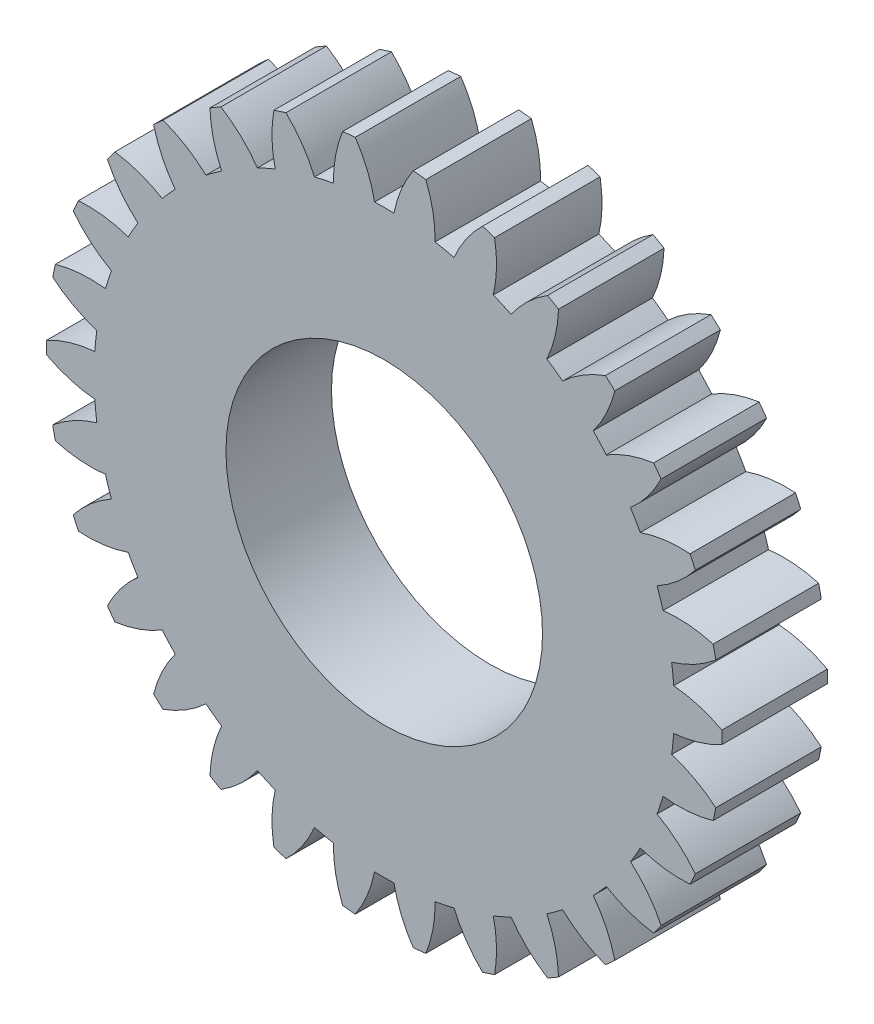
from build123d import *

# Parameters (mm, degrees)
SKETCH_1_R      = 15
EXTRUDE_1_DEPTH = 10


with BuildPart() as part:
    # 草圖1 → 填料-伸長1 (new body)
    with BuildSketch(Plane.XY):
        with BuildLine():
            ThreePointArc((-31.994334603, -0.602124009), (-29.77973059, -1.509475958), (-27.429110937, -1.959304527))
            ThreePointArc((-27.429110937, -1.959304527), (-27.348357601, -2.874428211), (-27.23708137, -3.786343811))
            ThreePointArc((-27.23708137, -3.786343811), (-29.442809726, -4.715063852), (-31.42037025, -6.063030049))
            ThreePointArc((-31.42037025, -6.063030049), (-31.300723223, -6.653174106), (-31.169993008, -7.240962359))
            ThreePointArc((-31.169993008, -7.240962359), (-28.815134328, -7.668044426), (-26.422356736, -7.619321854))
            ThreePointArc((-26.422356736, -7.619321854), (-26.153103142, -8.497658328), (-25.854660649, -9.366510754))
            ThreePointArc((-25.854660649, -9.366510754), (-27.819096794, -10.733532747), (-29.473184945, -12.4632006))
            ThreePointArc((-29.473184945, -12.4632006), (-29.233454645, -13.015572578), (-28.983373149, -13.563335907))
            ThreePointArc((-28.983373149, -13.563335907), (-26.591178426, -13.491482557), (-24.260818757, -12.946338255))
            ThreePointArc((-24.260818757, -12.946338255), (-23.814832579, -13.7495), (-23.342267194, -14.537316233))
            ThreePointArc((-23.342267194, -14.537316233), (-24.979555842, -16.282894755), (-26.23788003, -18.31866948))
            ThreePointArc((-26.23788003, -18.31866948), (-25.88854382, -18.809128073), (-25.530040805, -19.292926592))
            ThreePointArc((-25.530040805, -19.292926592), (-23.205060428, -18.725278161), (-21.038966583, -17.707537551))
            ThreePointArc((-21.038966583, -17.707537551), (-20.435739556, -18.400422544), (-19.809704653, -19.072771234))
            ThreePointArc((-19.809704653, -19.072771234), (-21.048288434, -21.120616129), (-21.855853854, -23.373524601))
            ThreePointArc((-21.855853854, -23.373524601), (-21.412179403, -23.780634415), (-20.960923171, -24.179323808))
            ThreePointArc((-20.960923171, -24.179323808), (-18.804769939, -23.140689255), (-16.897610612, -21.694832486))
            ThreePointArc((-16.897610612, -21.694832486), (-16.163506653, -22.247158328), (-15.411362962, -22.774654611))
            ThreePointArc((-15.411362962, -22.774654611), (-16.197109821, -25.035265229), (-16.518621989, -27.406844539))
            ThreePointArc((-16.518621989, -27.406844539), (-16, -27.712812921), (-15.475712613, -28.008968548))
            ThreePointArc((-15.475712613, -28.008968548), (-13.582620769, -26.544741188), (-12.017747974, -24.733959138))
            ThreePointArc((-12.017747974, -24.733959138), (-11.184850948, -25.12158654), (-10.339470758, -25.481176297))
            ThreePointArc((-10.339470758, -25.481176297), (-10.638039786, -27.855753107), (-10.459447078, -30.242353857))
            ThreePointArc((-10.459447078, -30.242353857), (-9.88854382, -30.433808521), (-9.314139154, -30.61448696))
            ThreePointArc((-9.314139154, -30.61448696), (-7.766845894, -28.788660555), (-6.612652082, -26.692093088))
            ThreePointArc((-6.612652082, -26.692093088), (-5.717363586, -26.898080873), (-4.815694067, -27.074048306))
            ThreePointArc((-4.815694067, -27.074048306), (-4.614036366, -29.458810907), (-3.94314414, -31.756127193))
            ThreePointArc((-3.94314414, -31.756127193), (-3.344910825, -31.824700652), (-2.745493119, -31.882005388))
            ThreePointArc((-2.745493119, -31.882005388), (-1.611622584, -29.774377312), (-0.918551563, -27.483654488))
            ThreePointArc((-0.918551563, -27.483654488), (0, -27.499), (0.918551563, -27.483654488))
            ThreePointArc((0.918551563, -27.483654488), (1.611622584, -29.774377312), (2.745493119, -31.882005388))
            ThreePointArc((2.745493119, -31.882005388), (3.344910825, -31.824700652), (3.94314414, -31.756127193))
            ThreePointArc((3.94314414, -31.756127193), (4.614036366, -29.458810907), (4.815694067, -27.074048306))
            ThreePointArc((4.815694067, -27.074048306), (5.717363586, -26.898080873), (6.612652082, -26.692093088))
            ThreePointArc((6.612652082, -26.692093088), (7.766845894, -28.788660555), (9.314139154, -30.61448696))
            ThreePointArc((9.314139154, -30.61448696), (9.88854382, -30.433808521), (10.459447078, -30.242353857))
            ThreePointArc((10.459447078, -30.242353857), (10.638039786, -27.855753107), (10.339470758, -25.481176297))
            ThreePointArc((10.339470758, -25.481176297), (11.184850948, -25.12158654), (12.017747974, -24.733959138))
            ThreePointArc((12.017747974, -24.733959138), (13.582620769, -26.544741188), (15.475712613, -28.008968548))
            ThreePointArc((15.475712613, -28.008968548), (16, -27.712812921), (16.518621989, -27.406844539))
            ThreePointArc((16.518621989, -27.406844539), (16.197109821, -25.035265229), (15.411362962, -22.774654611))
            ThreePointArc((15.411362962, -22.774654611), (16.163506653, -22.247158328), (16.897610612, -21.694832486))
            ThreePointArc((16.897610612, -21.694832486), (18.804769939, -23.140689255), (20.960923171, -24.179323808))
            ThreePointArc((20.960923171, -24.179323808), (21.412179403, -23.780634415), (21.855853854, -23.373524601))
            ThreePointArc((21.855853854, -23.373524601), (21.048288434, -21.120616129), (19.809704653, -19.072771234))
            ThreePointArc((19.809704653, -19.072771234), (20.435739556, -18.400422544), (21.038966583, -17.707537551))
            ThreePointArc((21.038966583, -17.707537551), (23.205060428, -18.725278161), (25.530040805, -19.292926592))
            ThreePointArc((25.530040805, -19.292926592), (25.88854382, -18.809128073), (26.23788003, -18.31866948))
            ThreePointArc((26.23788003, -18.31866948), (24.979555842, -16.282894755), (23.342267194, -14.537316233))
            ThreePointArc((23.342267194, -14.537316233), (23.814832579, -13.7495), (24.260818757, -12.946338255))
            ThreePointArc((24.260818757, -12.946338255), (26.591178426, -13.491482557), (28.983373149, -13.563335907))
            ThreePointArc((28.983373149, -13.563335907), (29.233454645, -13.015572578), (29.473184945, -12.4632006))
            ThreePointArc((29.473184945, -12.4632006), (27.819096794, -10.733532747), (25.854660649, -9.366510754))
            ThreePointArc((25.854660649, -9.366510754), (26.153103142, -8.497658328), (26.422356736, -7.619321854))
            ThreePointArc((26.422356736, -7.619321854), (28.815134328, -7.668044426), (31.169993008, -7.240962359))
            ThreePointArc((31.169993008, -7.240962359), (31.300723223, -6.653174106), (31.42037025, -6.063030049))
            ThreePointArc((31.42037025, -6.063030049), (29.442809726, -4.715063852), (27.23708137, -3.786343811))
            ThreePointArc((27.23708137, -3.786343811), (27.348357601, -2.874428211), (27.429110937, -1.959304527))
            ThreePointArc((27.429110937, -1.959304527), (29.77973059, -1.509475958), (31.994334603, -0.602124009))
            ThreePointArc((31.994334603, -0.602124009), (32, 0), (31.994334603, 0.602124009))
            ThreePointArc((31.994334603, 0.602124009), (29.77973059, 1.509475958), (27.429110937, 1.959304527))
            ThreePointArc((27.429110937, 1.959304527), (27.348357601, 2.874428211), (27.23708137, 3.786343811))
            ThreePointArc((27.23708137, 3.786343811), (29.442809726, 4.715063852), (31.42037025, 6.063030049))
            ThreePointArc((31.42037025, 6.063030049), (31.300723223, 6.653174106), (31.169993008, 7.240962359))
            ThreePointArc((31.169993008, 7.240962359), (28.815134328, 7.668044426), (26.422356736, 7.619321854))
            ThreePointArc((26.422356736, 7.619321854), (26.153103142, 8.497658328), (25.854660649, 9.366510754))
            ThreePointArc((25.854660649, 9.366510754), (27.819096794, 10.733532747), (29.473184945, 12.4632006))
            ThreePointArc((29.473184945, 12.4632006), (29.233454645, 13.015572578), (28.983373149, 13.563335907))
            ThreePointArc((28.983373149, 13.563335907), (26.591178426, 13.491482557), (24.260818757, 12.946338255))
            ThreePointArc((24.260818757, 12.946338255), (23.814832579, 13.7495), (23.342267194, 14.537316233))
            ThreePointArc((23.342267194, 14.537316233), (24.979555842, 16.282894755), (26.23788003, 18.31866948))
            ThreePointArc((26.23788003, 18.31866948), (25.88854382, 18.809128073), (25.530040805, 19.292926592))
            ThreePointArc((25.530040805, 19.292926592), (23.205060428, 18.725278161), (21.038966583, 17.707537551))
            ThreePointArc((21.038966583, 17.707537551), (20.435739556, 18.400422544), (19.809704653, 19.072771234))
            ThreePointArc((19.809704653, 19.072771234), (21.048288434, 21.120616129), (21.855853854, 23.373524601))
            ThreePointArc((21.855853854, 23.373524601), (21.412179403, 23.780634415), (20.960923171, 24.179323808))
            ThreePointArc((20.960923171, 24.179323808), (18.804769939, 23.140689255), (16.897610612, 21.694832486))
            ThreePointArc((16.897610612, 21.694832486), (16.163506653, 22.247158328), (15.411362962, 22.774654611))
            ThreePointArc((15.411362962, 22.774654611), (16.197109821, 25.035265229), (16.518621989, 27.406844539))
            ThreePointArc((16.518621989, 27.406844539), (16, 27.712812921), (15.475712613, 28.008968548))
            ThreePointArc((15.475712613, 28.008968548), (13.582620769, 26.544741188), (12.017747974, 24.733959138))
            ThreePointArc((12.017747974, 24.733959138), (11.184850948, 25.12158654), (10.339470758, 25.481176297))
            ThreePointArc((10.339470758, 25.481176297), (10.638039786, 27.855753107), (10.459447078, 30.242353857))
            ThreePointArc((10.459447078, 30.242353857), (9.88854382, 30.433808521), (9.314139154, 30.61448696))
            ThreePointArc((9.314139154, 30.61448696), (7.766845894, 28.788660555), (6.612652082, 26.692093088))
            ThreePointArc((6.612652082, 26.692093088), (5.717363586, 26.898080873), (4.815694067, 27.074048306))
            ThreePointArc((4.815694067, 27.074048306), (4.614036366, 29.458810907), (3.94314414, 31.756127193))
            ThreePointArc((3.94314414, 31.756127193), (3.344910825, 31.824700652), (2.745493119, 31.882005388))
            ThreePointArc((2.745493119, 31.882005388), (1.611622584, 29.774377312), (0.918551563, 27.483654488))
            ThreePointArc((0.918551563, 27.483654488), (0, 27.499), (-0.918551563, 27.483654488))
            ThreePointArc((-0.918551563, 27.483654488), (-1.611622584, 29.774377312), (-2.745493119, 31.882005388))
            ThreePointArc((-2.745493119, 31.882005388), (-3.344910825, 31.824700652), (-3.94314414, 31.756127193))
            ThreePointArc((-3.94314414, 31.756127193), (-4.614036366, 29.458810907), (-4.815694067, 27.074048306))
            ThreePointArc((-4.815694067, 27.074048306), (-5.717363586, 26.898080873), (-6.612652082, 26.692093088))
            ThreePointArc((-6.612652082, 26.692093088), (-7.766845894, 28.788660555), (-9.314139154, 30.61448696))
            ThreePointArc((-9.314139154, 30.61448696), (-9.88854382, 30.433808521), (-10.459447078, 30.242353857))
            ThreePointArc((-10.459447078, 30.242353857), (-10.638039786, 27.855753107), (-10.339470758, 25.481176297))
            ThreePointArc((-10.339470758, 25.481176297), (-11.184850948, 25.12158654), (-12.017747974, 24.733959138))
            ThreePointArc((-12.017747974, 24.733959138), (-13.582620769, 26.544741188), (-15.475712613, 28.008968548))
            ThreePointArc((-15.475712613, 28.008968548), (-16, 27.712812921), (-16.518621989, 27.406844539))
            ThreePointArc((-16.518621989, 27.406844539), (-16.197109821, 25.035265229), (-15.411362962, 22.774654611))
            ThreePointArc((-15.411362962, 22.774654611), (-16.163506653, 22.247158328), (-16.897610612, 21.694832486))
            ThreePointArc((-16.897610612, 21.694832486), (-18.804769939, 23.140689255), (-20.960923171, 24.179323808))
            ThreePointArc((-20.960923171, 24.179323808), (-21.412179403, 23.780634415), (-21.855853854, 23.373524601))
            ThreePointArc((-21.855853854, 23.373524601), (-21.048288434, 21.120616129), (-19.809704653, 19.072771234))
            ThreePointArc((-19.809704653, 19.072771234), (-20.435739556, 18.400422544), (-21.038966583, 17.707537551))
            ThreePointArc((-21.038966583, 17.707537551), (-23.205060428, 18.725278161), (-25.530040805, 19.292926592))
            ThreePointArc((-25.530040805, 19.292926592), (-25.88854382, 18.809128073), (-26.23788003, 18.31866948))
            ThreePointArc((-26.23788003, 18.31866948), (-24.979555842, 16.282894755), (-23.342267194, 14.537316233))
            ThreePointArc((-23.342267194, 14.537316233), (-23.814832579, 13.7495), (-24.260818757, 12.946338255))
            ThreePointArc((-24.260818757, 12.946338255), (-26.591178426, 13.491482557), (-28.983373149, 13.563335907))
            ThreePointArc((-28.983373149, 13.563335907), (-29.233454645, 13.015572578), (-29.473184945, 12.4632006))
            ThreePointArc((-29.473184945, 12.4632006), (-27.819096794, 10.733532747), (-25.854660649, 9.366510754))
            ThreePointArc((-25.854660649, 9.366510754), (-26.153103142, 8.497658328), (-26.422356736, 7.619321854))
            ThreePointArc((-26.422356736, 7.619321854), (-28.815134328, 7.668044426), (-31.169993008, 7.240962359))
            ThreePointArc((-31.169993008, 7.240962359), (-31.300723223, 6.653174106), (-31.42037025, 6.063030049))
            ThreePointArc((-31.42037025, 6.063030049), (-29.442809726, 4.715063852), (-27.23708137, 3.786343811))
            ThreePointArc((-27.23708137, 3.786343811), (-27.348357601, 2.874428211), (-27.429110937, 1.959304527))
            ThreePointArc((-27.429110937, 1.959304527), (-29.77973059, 1.509475958), (-31.994334603, 0.602124009))
            ThreePointArc((-31.994334603, 0.602124009), (-32, 0), (-31.994334603, -0.602124009))
        make_face()
        Circle(SKETCH_1_R, mode=Mode.SUBTRACT)
    extrude(amount=EXTRUDE_1_DEPTH)


solid = part.part
